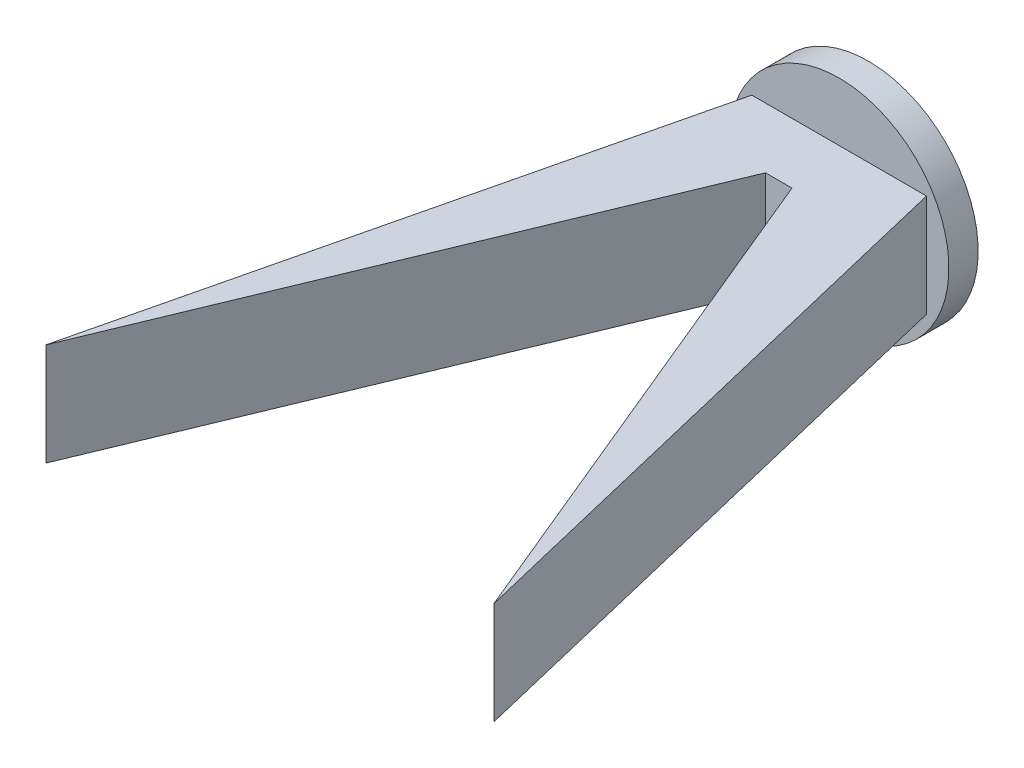
from build123d import *

# Parameters (mm, degrees)
BOSS_EXTRUDE1_DEPTH = 7
SKETCH2_R           = 7.5
BOSS_EXTRUDE2_DEPTH = 2


with BuildPart() as part:
    # Sketch1 → Boss-Extrude1 (new body)
    with BuildSketch(Plane(origin=(0, 0, 0), x_dir=(1, 0, 0), z_dir=(0, 1, 0))):
        Polygon((-15.307337295, -36.9551813), (-5.96952274, 1.939615515), (5.96952274, 1.939615515), (15.307337295, -36.9551813), (0.906459551, -2.188386941), (-0.906459551, -2.188386941), align=None)
    extrude(amount=BOSS_EXTRUDE1_DEPTH)

    # Sketch2 → Boss-Extrude2 (add)
    with BuildSketch(Plane(origin=(0, 0, -1.939615515), x_dir=(-1, 0, 0), z_dir=(0, 0, -1))):
        with Locations((0, 3.5)):
            Circle(SKETCH2_R)
    extrude(amount=BOSS_EXTRUDE2_DEPTH)


solid = part.part
